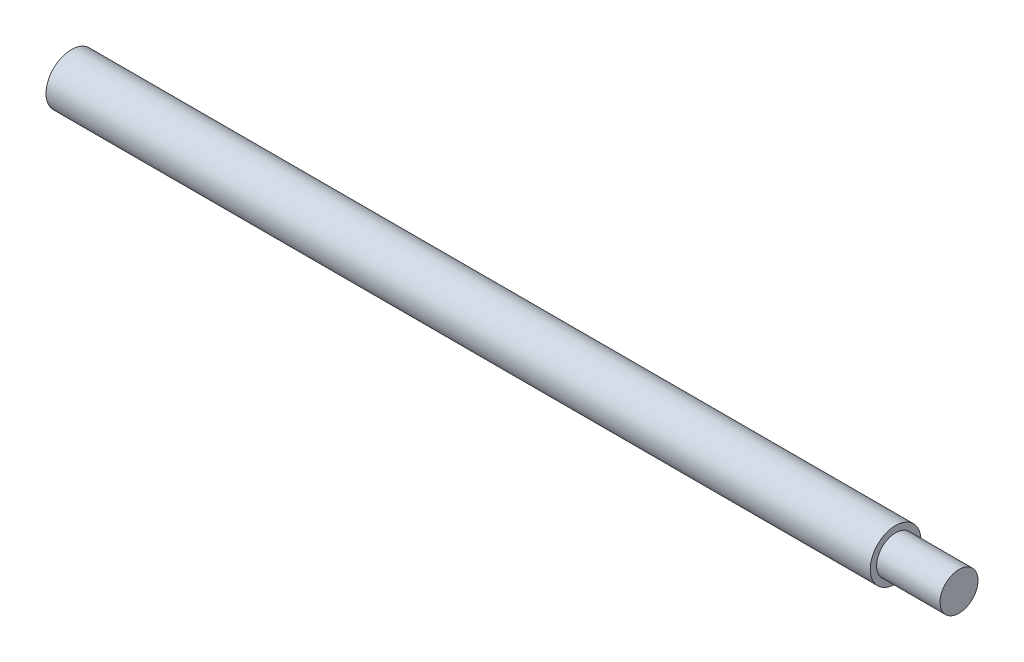
from build123d import *

# Parameters (mm, degrees)
SKETCH1_R           = 4
BOSS_EXTRUDE1_DEPTH = 70
SKETCH7_OUTSIDE_W   = 38.092
SKETCH7_OUTSIDE_H   = 38.092
SKETCH7_OUTSIDE_R   = 3
CUT_EXTRUDE4_DEPTH  = 10


with BuildPart() as part:
    # Sketch1 → Boss-Extrude1 (new, symmetric)
    with BuildSketch(Plane(origin=(0, 0, 0), x_dir=(0, 0, -1), z_dir=(1, 0, 0))):
        Circle(SKETCH1_R)
    extrude(amount=BOSS_EXTRUDE1_DEPTH, both=True)

    # Sketch7 outside → Cut-Extrude4 (cut)
    with BuildSketch(Plane.ZY.offset(-70)):
        Rectangle(SKETCH7_OUTSIDE_W, SKETCH7_OUTSIDE_H)
        Circle(SKETCH7_OUTSIDE_R, mode=Mode.SUBTRACT)
    extrude(amount=CUT_EXTRUDE4_DEPTH, mode=Mode.SUBTRACT)


solid = part.part
